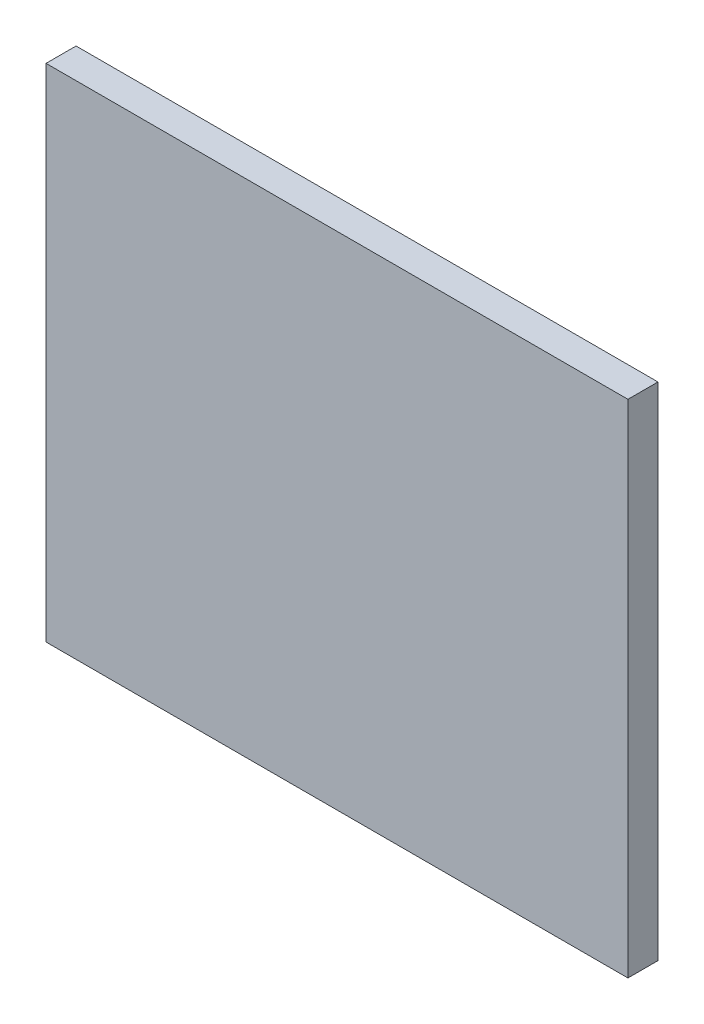
from build123d import *

# Parameters (mm, degrees)
SKICA1_W                = 31
SKICA1_H                = 26.7
P_IDAT_VYSUNUT_M1_DEPTH = 1.6


with BuildPart() as part:
    # Skica1 → Přidat vysunutím1 (new body)
    with BuildSketch(Plane.XY):
        Rectangle(SKICA1_W, SKICA1_H)
    extrude(amount=P_IDAT_VYSUNUT_M1_DEPTH)


solid = part.part
